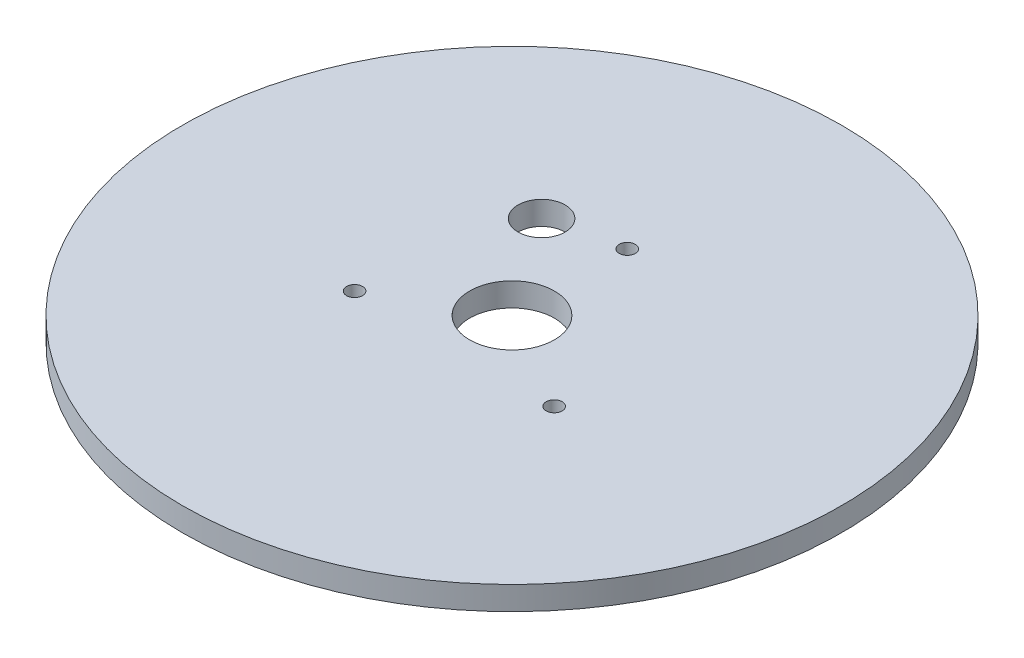
from build123d import *

# Parameters (mm, degrees)
SKETCH1_R           = 88.9
SKETCH1_R_2         = 11.43
SKETCH1_R_3         = 2.159
SKETCH1_R_4         = 6.35
BOSS_EXTRUDE1_DEPTH = 6.35


with BuildPart() as part:
    # Sketch1 → Boss-Extrude1 (new body)
    with BuildSketch(Plane(origin=(0, 0, 0), x_dir=(1, 0, 0), z_dir=(0, 1, 0))):
        with Locations(Location((0, 0, 0), (0, 0, 270))):
            Circle(SKETCH1_R)
        with Locations(Location((0, 0, 0), (0, 0, 270))):
            Circle(SKETCH1_R_2, mode=Mode.SUBTRACT)
        with Locations(Location((0, 31.089, 0), (0, 0, 270))):
            Circle(SKETCH1_R_3, mode=Mode.SUBTRACT)
        with Locations(Location((26.923863778, -15.5445, 0), (0, 0, 270))):
            Circle(SKETCH1_R_3, mode=Mode.SUBTRACT)
        with Locations(Location((-26.923863778, -15.5445, 0), (0, 0, 270))):
            Circle(SKETCH1_R_3, mode=Mode.SUBTRACT)
        with Locations(Location((-18.648117099, 26.632271264, 0), (0, 0, 270))):
            Circle(SKETCH1_R_4, mode=Mode.SUBTRACT)
    extrude(amount=BOSS_EXTRUDE1_DEPTH)


solid = part.part
